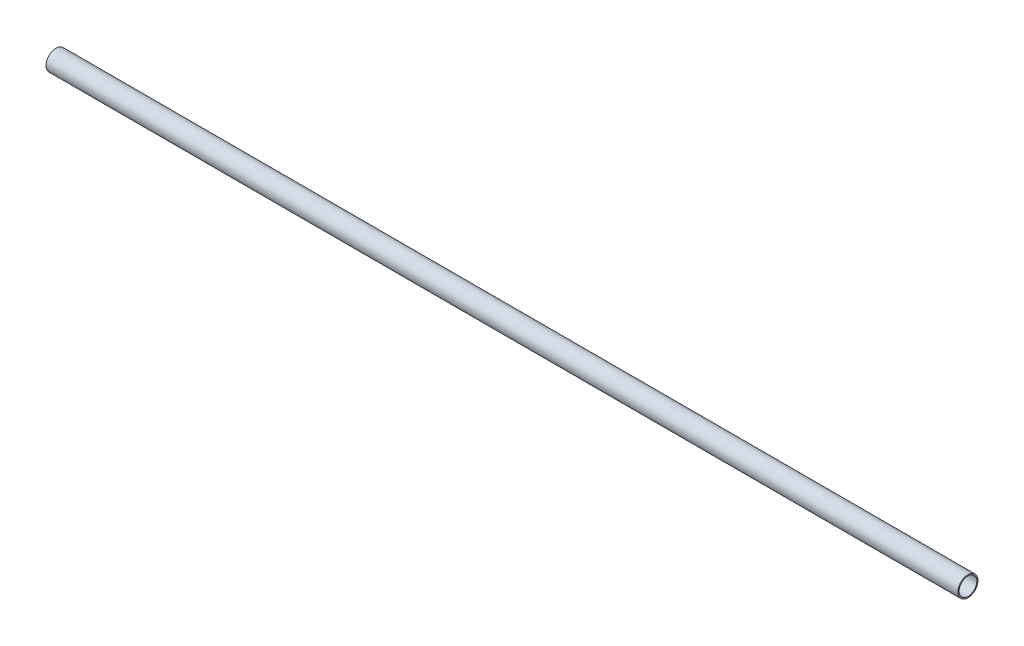
from build123d import *

# Parameters (mm, degrees)
SKETCH1_R           = 8.9662
SKETCH1_R_2         = 7.8994
BOSS_EXTRUDE1_DEPTH = 812.8


with BuildPart() as part:
    # Sketch1 → Boss-Extrude1 (new body)
    with BuildSketch(Plane(origin=(0, 0, 0), x_dir=(0, 0, -1), z_dir=(1, 0, 0))):
        Circle(SKETCH1_R)
        Circle(SKETCH1_R_2, mode=Mode.SUBTRACT)
    extrude(amount=BOSS_EXTRUDE1_DEPTH)


solid = part.part
